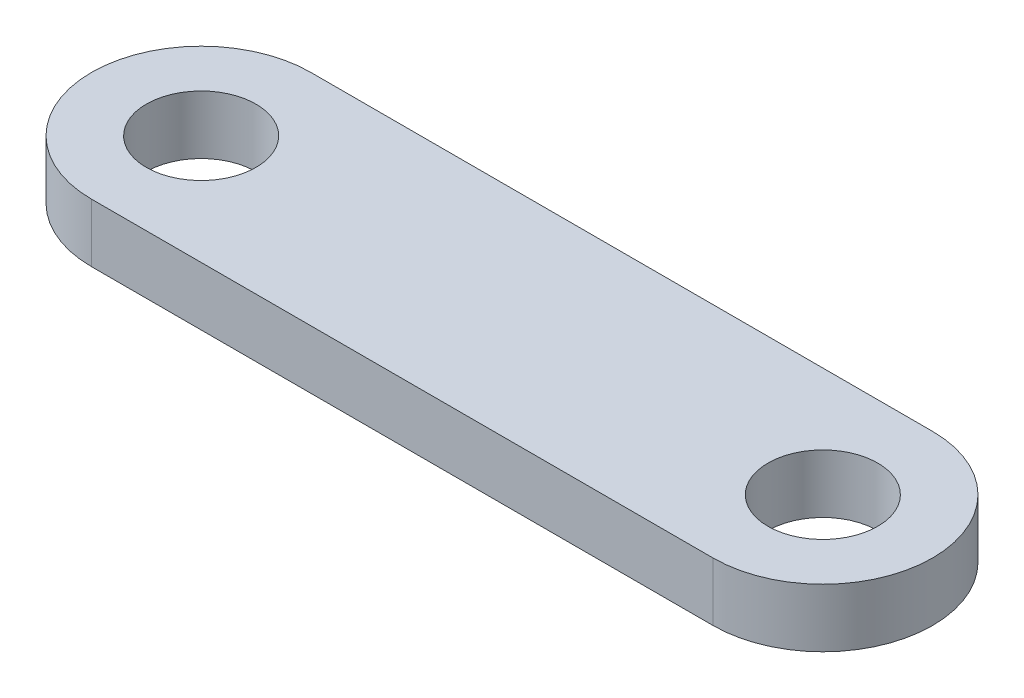
from build123d import *

# Parameters (mm, degrees)
SKETCH1_R           = 9.525
BOSS_EXTRUDE1_DEPTH = 10.16


with BuildPart() as part:
    # Sketch1 → Boss-Extrude1 (new body)
    with BuildSketch(Plane(origin=(0, 0, 0), x_dir=(1, 0, 0), z_dir=(0, 1, 0))):
        with BuildLine():
            Line((-107.95, 19.05), (0, 19.05))
            ThreePointArc((0, 19.05), (19.05, 0), (0, -19.05))
            Line((0, -19.05), (-107.95, -19.05))
            ThreePointArc((-107.95, -19.05), (-127, 0), (-107.95, 19.05))
        make_face()
        with Locations(Location((-107.95, 0, 0), (0, 0, 270))):
            Circle(SKETCH1_R, mode=Mode.SUBTRACT)
        with Locations(Location((0, 0, 0), (0, 0, 270))):
            Circle(SKETCH1_R, mode=Mode.SUBTRACT)
    extrude(amount=BOSS_EXTRUDE1_DEPTH)


solid = part.part
